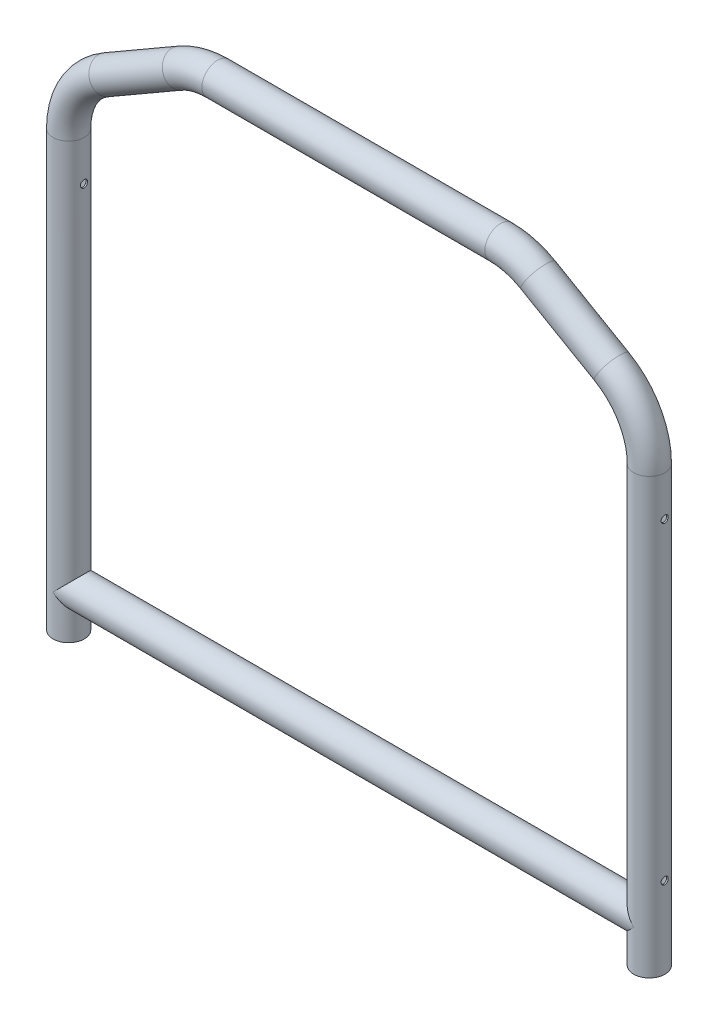
from build123d import *

# Parameters (mm, degrees)
SKETCH2_R                            = 11
SKETCH2_R_2                          = 10
BOSS_EXTRUDE1_REACH                  = 445.723
BOSS_EXTRUDE1_END_RADIUS             = 11
SKETCH3_R                            = 11
SKETCH3_R_2                          = 10
BOSS_EXTRUDE1_DIRECTION_2_REACH      = 445.723
BOSS_EXTRUDE1_DIRECTION_2_END_RADIUS = 11
SKETCH5_R                            = 2.5
CUT_EXTRUDE1_DEPTH                   = 200
SKETCH6_R                            = 2.5
CUT_EXTRUDE2_DEPTH                   = 200


with BuildPart() as part:
    # Sweep1: sweep along a path in Sketch1
    with BuildLine(Plane.XY) as sweep1_path:
        Line((204, -388), (204, -82.797389364))
        ThreePointArc((204, -82.797389364), (196.899346401, -56.297389364), (177.5, -36.898042963))
        Line((177.5, -36.898042963), (125.889407689, -7.100653599))
        ThreePointArc((125.889407689, -7.100653599), (113.10681708, -1.805931207), (99.389407689, 0))
        Line((99.389407689, 0), (-99.389407689, 0))
        ThreePointArc((-99.389407689, 0), (-113.10681708, -1.805931207), (-125.889407689, -7.100653599))
        Line((-125.889407689, -7.100653599), (-177.5, -36.898042963))
        ThreePointArc((-177.5, -36.898042963), (-196.899346401, -56.297389364), (-204, -82.797389364))
        Line((-204, -82.797389364), (-204, -388))
    # Sketch2 → Sweep1 (sweep)
    with BuildSketch(Plane(origin=(204, -388, 0), x_dir=(-1, 0, 0), z_dir=(0, -1, 0))):
        Circle(SKETCH2_R)
        Circle(SKETCH2_R_2, mode=Mode.SUBTRACT)
    sweep(path=sweep1_path.line)

    # Boss-Extrude1: up to this cylinder (the profile starts outside it)
    boss_extrude1_end = Plane(origin=(204, -359.399207, 0), z_dir=(0, -1, 0)) * Cylinder(BOSS_EXTRUDE1_END_RADIUS, 914.446, mode=Mode.PRIVATE)
    # Sketch3 → Boss-Extrude1 (add, up to the surface)
    with BuildSketch(Plane(origin=(0, 0, 0), x_dir=(0, 0, -1), z_dir=(1, 0, 0)), mode=Mode.PRIVATE) as boss_extrude1_sk1:
        with Locations((0, -359.399206555)):
            Circle(SKETCH3_R)
        with Locations((0, -359.399206555)):
            Circle(SKETCH3_R_2, mode=Mode.SUBTRACT)
    boss_extrude1_tool1 = extrude(boss_extrude1_sk1.sketch, amount=BOSS_EXTRUDE1_REACH, mode=Mode.PRIVATE) - boss_extrude1_end
    add(boss_extrude1_tool1.solids().sort_by_distance((0, -359.399207, 10.688873))[0])

    # Boss-Extrude1 direction 2: up to this cylinder (the profile starts outside it)
    boss_extrude1_direction_2_end = Plane(origin=(-204, -359.399207, 0), z_dir=(0, 1, 0)) * Cylinder(BOSS_EXTRUDE1_DIRECTION_2_END_RADIUS, 914.446, mode=Mode.PRIVATE)
    # Sketch3 → Boss-Extrude1 direction 2 (add, up to the surface)
    with BuildSketch(Plane(origin=(0, 0, 0), x_dir=(0, 0, -1), z_dir=(1, 0, 0)), mode=Mode.PRIVATE) as boss_extrude1_direction_2_sk1:
        with Locations((0, -359.399206555)):
            Circle(SKETCH3_R)
        with Locations((0, -359.399206555)):
            Circle(SKETCH3_R_2, mode=Mode.SUBTRACT)
    boss_extrude1_direction_2_tool1 = extrude(boss_extrude1_direction_2_sk1.sketch, amount=-BOSS_EXTRUDE1_DIRECTION_2_REACH, mode=Mode.PRIVATE) - boss_extrude1_direction_2_end
    add(boss_extrude1_direction_2_tool1.solids().sort_by_distance((0, -359.399207, 10.688873))[0])

    # Sketch5 → Cut-Extrude1 (cut)
    with BuildSketch(Plane(origin=(-204, -388, 0), x_dir=(0, 0, 1), z_dir=(-1, 0, 0))):
        with Locations((0, 57)):
            Circle(SKETCH5_R)
    cut_extrude1 = extrude(amount=CUT_EXTRUDE1_DEPTH, mode=Mode.SUBTRACT)

    # Sketch6 → Cut-Extrude2 (cut, symmetric)
    with BuildSketch(Plane(origin=(-204, -388, 0), x_dir=(0, 0, 1), z_dir=(-1, 0, 0))):
        with Locations((0, 277)):
            Circle(SKETCH6_R)
    cut_extrude2 = extrude(amount=CUT_EXTRUDE2_DEPTH, both=True, mode=Mode.SUBTRACT)

    # Mirror1: Cut-Extrude1, Cut-Extrude2 across plane
    add(cut_extrude1.mirror(Plane(origin=(0, 0, 0), x_dir=(0, 0, 1), z_dir=(1, 0, 0))), mode=Mode.SUBTRACT)
    add(cut_extrude2.mirror(Plane(origin=(0, 0, 0), x_dir=(0, 0, 1), z_dir=(1, 0, 0))), mode=Mode.SUBTRACT)


solid = part.part
